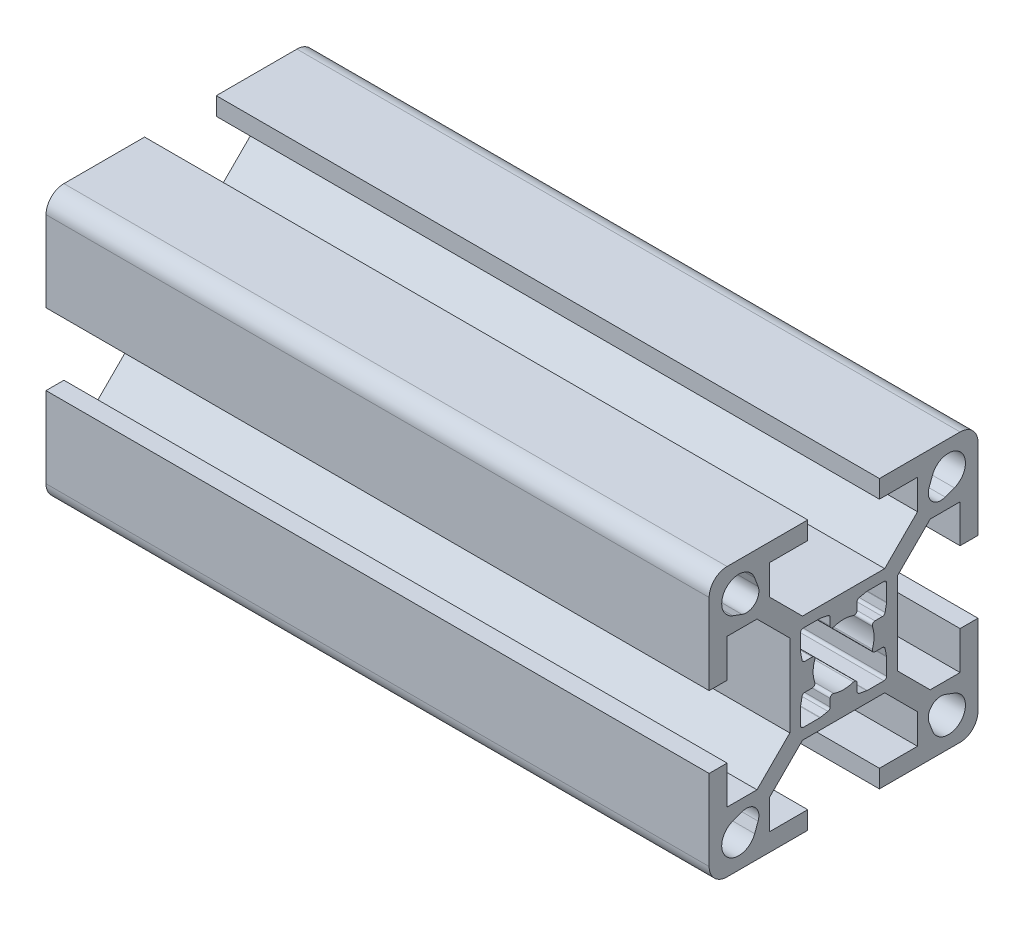
from build123d import *

# Parameters (mm, degrees)
BOSS_EXTRUDE1_DEPTH = 74


with BuildPart() as part:
    # Sketch1 → Boss-Extrude1 (new body)
    with BuildSketch(Plane(origin=(0, 0, 0), x_dir=(0, 0, -1), z_dir=(1, 0, 0))):
        with BuildLine():
            Line((-15, 13), (-15, 4))
            Line((-15, 4), (-13, 4))
            Line((-13, 4), (-13, 8.25))
            Line((-13, 8.25), (-9.664213562, 8.25))
            Line((-9.664213562, 8.25), (-6, 4.585786438))
            Line((-6, 4.585786438), (-6, -4.585786438))
            Line((-6, -4.585786438), (-9.664213562, -8.25))
            Line((-9.664213562, -8.25), (-13, -8.25))
            Line((-13, -8.25), (-13, -4))
            Line((-13, -4), (-15, -4))
            Line((-15, -4), (-15, -13))
            ThreePointArc((-15, -13), (-14.414213562, -14.414213562), (-13, -15))
            Line((-13, -15), (-4, -15))
            Line((-4, -15), (-4, -13))
            Line((-4, -13), (-8.25, -13))
            Line((-8.25, -13), (-8.25, -9.664213562))
            Line((-8.25, -9.664213562), (-4.585786438, -6))
            Line((-4.585786438, -6), (4.585786438, -6))
            Line((4.585786438, -6), (8.25, -9.664213562))
            Line((8.25, -9.664213562), (8.25, -13))
            Line((8.25, -13), (4, -13))
            Line((4, -13), (4, -15))
            Line((4, -15), (13, -15))
            ThreePointArc((13, -15), (14.414213562, -14.414213562), (15, -13))
            Line((15, -13), (15, -4))
            Line((15, -4), (13, -4))
            Line((13, -4), (13, -8.25))
            Line((13, -8.25), (9.664213562, -8.25))
            Line((9.664213562, -8.25), (6, -4.585786438))
            Line((6, -4.585786438), (6, 4.585786438))
            Line((6, 4.585786438), (9.664213562, 8.25))
            Line((9.664213562, 8.25), (13, 8.25))
            Line((13, 8.25), (13, 4))
            Line((13, 4), (15, 4))
            Line((15, 4), (15, 13))
            ThreePointArc((15, 13), (14.414213562, 14.414213562), (13, 15))
            Line((13, 15), (4, 15))
            Line((4, 15), (4, 13))
            Line((4, 13), (8.25, 13))
            Line((8.25, 13), (8.25, 9.664213562))
            Line((8.25, 9.664213562), (4.585786438, 6))
            Line((4.585786438, 6), (-4.585786438, 6))
            Line((-4.585786438, 6), (-8.25, 9.664213562))
            Line((-8.25, 9.664213562), (-8.25, 13))
            Line((-8.25, 13), (-4, 13))
            Line((-4, 13), (-4, 15))
            Line((-4, 15), (-13, 15))
            ThreePointArc((-13, 15), (-14.414213562, 14.414213562), (-15, 13))
        make_face()
        with BuildLine():
            Line((-9.539070071, 11.338915743), (-9.918883282, 12.361530981))
            ThreePointArc((-9.918883282, 12.361530981), (-13.043502884, 13.043502884), (-12.361530981, 9.918883282))
            Line((-12.361530981, 9.918883282), (-11.338915743, 9.539070071))
            ThreePointArc((-11.338915743, 9.539070071), (-9.861522369, 9.861522369), (-9.539070071, 11.338915743))
        make_face(mode=Mode.SUBTRACT)
        with BuildLine():
            Line((9.918883282, 12.361530981), (9.539070071, 11.338915743))
            ThreePointArc((9.539070071, 11.338915743), (9.861522369, 9.861522369), (11.338915743, 9.539070071))
            Line((11.338915743, 9.539070071), (12.361530981, 9.918883282))
            ThreePointArc((12.361530981, 9.918883282), (13.043502884, 13.043502884), (9.918883282, 12.361530981))
        make_face(mode=Mode.SUBTRACT)
        with BuildLine():
            Line((12.361530981, -9.918883282), (11.338915743, -9.539070071))
            ThreePointArc((11.338915743, -9.539070071), (9.861522369, -9.861522369), (9.539070071, -11.338915743))
            Line((9.539070071, -11.338915743), (9.918883282, -12.361530981))
            ThreePointArc((9.918883282, -12.361530981), (13.043502884, -13.043502884), (12.361530981, -9.918883282))
        make_face(mode=Mode.SUBTRACT)
        with BuildLine():
            Line((-11.338915743, -9.539070071), (-12.361530981, -9.918883282))
            ThreePointArc((-12.361530981, -9.918883282), (-13.043502884, -13.043502884), (-9.918883282, -12.361530981))
            Line((-9.918883282, -12.361530981), (-9.539070071, -11.338915743))
            ThreePointArc((-9.539070071, -11.338915743), (-9.861522369, -9.861522369), (-11.338915743, -9.539070071))
        make_face(mode=Mode.SUBTRACT)
        with BuildLine():
            Line((-4.8, -2.644433572), (-4.8, -4.5))
            ThreePointArc((-4.8, -4.5), (-4.712132034, -4.712132034), (-4.5, -4.8))
            Line((-4.5, -4.8), (-2.644433572, -4.8))
            ThreePointArc((-2.644433572, -4.8), (-2.615679847, -4.79861886), (-2.587190874, -4.794488155))
            Line((-2.587190874, -4.794488155), (-1.742757301, -4.630346896))
            ThreePointArc((-1.742757301, -4.630346896), (-1.568512625, -4.526682207), (-1.5, -4.335858741))
            Line((-1.5, -4.335858741), (-1.5, -3.5))
            ThreePointArc((-1.5, -3.5), (-1.374371458, -3.255879959), (-1.102702703, -3.216216216))
            ThreePointArc((-1.102702703, -3.216216216), (0, -3.4), (1.102702703, -3.216216216))
            ThreePointArc((1.102702703, -3.216216216), (1.374371458, -3.255879959), (1.5, -3.5))
            Line((1.5, -3.5), (1.5, -4.335858741))
            ThreePointArc((1.5, -4.335858741), (1.568512625, -4.526682207), (1.742757301, -4.630346896))
            Line((1.742757301, -4.630346896), (2.587190874, -4.794488155))
            ThreePointArc((2.587190874, -4.794488155), (2.615679847, -4.79861886), (2.644433572, -4.8))
            Line((2.644433572, -4.8), (4.5, -4.8))
            ThreePointArc((4.5, -4.8), (4.712132034, -4.712132034), (4.8, -4.5))
            Line((4.8, -4.5), (4.8, -2.644433572))
            ThreePointArc((4.8, -2.644433572), (4.79861886, -2.615679847), (4.794488155, -2.587190874))
            Line((4.794488155, -2.587190874), (4.630346896, -1.742757301))
            ThreePointArc((4.630346896, -1.742757301), (4.526682207, -1.568512625), (4.335858741, -1.5))
            Line((4.335858741, -1.5), (3.5, -1.5))
            ThreePointArc((3.5, -1.5), (3.255879959, -1.374371458), (3.216216216, -1.102702703))
            ThreePointArc((3.216216216, -1.102702703), (3.4, 0), (3.216216216, 1.102702703))
            ThreePointArc((3.216216216, 1.102702703), (3.255879959, 1.374371458), (3.5, 1.5))
            Line((3.5, 1.5), (4.335858741, 1.5))
            ThreePointArc((4.335858741, 1.5), (4.526682207, 1.568512625), (4.630346896, 1.742757301))
            Line((4.630346896, 1.742757301), (4.794488155, 2.587190874))
            ThreePointArc((4.794488155, 2.587190874), (4.79861886, 2.615679847), (4.8, 2.644433572))
            Line((4.8, 2.644433572), (4.8, 4.5))
            ThreePointArc((4.8, 4.5), (4.712132034, 4.712132034), (4.5, 4.8))
            Line((4.5, 4.8), (2.644433572, 4.8))
            ThreePointArc((2.644433572, 4.8), (2.615679847, 4.79861886), (2.587190874, 4.794488155))
            Line((2.587190874, 4.794488155), (1.742757301, 4.630346896))
            ThreePointArc((1.742757301, 4.630346896), (1.568512625, 4.526682207), (1.5, 4.335858741))
            Line((1.5, 4.335858741), (1.5, 3.5))
            ThreePointArc((1.5, 3.5), (1.374371458, 3.255879959), (1.102702703, 3.216216216))
            ThreePointArc((1.102702703, 3.216216216), (0, 3.4), (-1.102702703, 3.216216216))
            ThreePointArc((-1.102702703, 3.216216216), (-1.374371458, 3.255879959), (-1.5, 3.5))
            Line((-1.5, 3.5), (-1.5, 4.335858741))
            ThreePointArc((-1.5, 4.335858741), (-1.568512625, 4.526682207), (-1.742757301, 4.630346896))
            Line((-1.742757301, 4.630346896), (-2.587190874, 4.794488155))
            ThreePointArc((-2.587190874, 4.794488155), (-2.615679847, 4.79861886), (-2.644433572, 4.8))
            Line((-2.644433572, 4.8), (-4.5, 4.8))
            ThreePointArc((-4.5, 4.8), (-4.712132034, 4.712132034), (-4.8, 4.5))
            Line((-4.8, 4.5), (-4.8, 2.644433572))
            ThreePointArc((-4.8, 2.644433572), (-4.79861886, 2.615679847), (-4.794488155, 2.587190874))
            Line((-4.794488155, 2.587190874), (-4.630346896, 1.742757301))
            ThreePointArc((-4.630346896, 1.742757301), (-4.526682207, 1.568512625), (-4.335858741, 1.5))
            Line((-4.335858741, 1.5), (-3.5, 1.5))
            ThreePointArc((-3.5, 1.5), (-3.255879959, 1.374371458), (-3.216216216, 1.102702703))
            ThreePointArc((-3.216216216, 1.102702703), (-3.4, 0), (-3.216216216, -1.102702703))
            ThreePointArc((-3.216216216, -1.102702703), (-3.255879959, -1.374371458), (-3.5, -1.5))
            Line((-3.5, -1.5), (-4.335858741, -1.5))
            ThreePointArc((-4.335858741, -1.5), (-4.526682207, -1.568512625), (-4.630346896, -1.742757301))
            Line((-4.630346896, -1.742757301), (-4.794488155, -2.587190874))
            ThreePointArc((-4.794488155, -2.587190874), (-4.79861886, -2.615679847), (-4.8, -2.644433572))
        make_face(mode=Mode.SUBTRACT)
    extrude(amount=BOSS_EXTRUDE1_DEPTH)


solid = part.part
